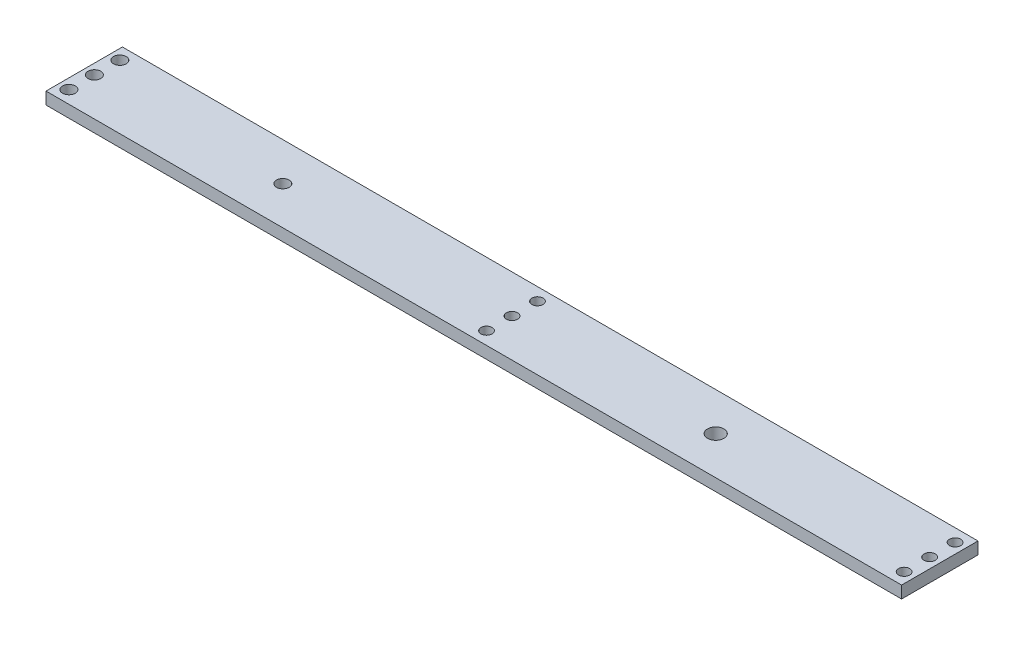
from build123d import *

# Parameters (mm, degrees)
ESBO_O1_R                = 2.5
ESBO_O1_R_2              = 2.2
ESBO_O1_R_3              = 3.225
ESBO_O1_W                = 8
ESBO_O1_H                = 30
RESSALTO_EXTRUS_O1_DEPTH = 4.7625


with BuildPart() as part:
    # Esboço1 → Ressalto-extrusão1 (new body)
    # profile 1 of 2: a face of its own
    with BuildSketch(Plane(origin=(0, 0, 0), x_dir=(1, 0, 0), z_dir=(0, 1, 0))):
        Polygon((-160, -15), (160, -15), (160, 15), (-160, 15), (-168, 15), (-168, -15), align=None)
        with Locations(Location((-164, -10, 0), (0, 0, 90))):
            Circle(ESBO_O1_R, mode=Mode.SUBTRACT)
        with Locations(Location((0, -10, 0), (0, 0, 90))):
            Circle(ESBO_O1_R_2, mode=Mode.SUBTRACT)
        with Locations(Location((-164, 0, 0), (0, 0, 90))):
            Circle(ESBO_O1_R, mode=Mode.SUBTRACT)
        with Locations(Location((-90, 0, 0), (0, 0, 90))):
            Circle(ESBO_O1_R, mode=Mode.SUBTRACT)
        with Locations(Location((-164, 10, 0), (0, 0, 90))):
            Circle(ESBO_O1_R, mode=Mode.SUBTRACT)
        with Locations(Location((0, 0, 0), (0, 0, 90))):
            Circle(ESBO_O1_R_2, mode=Mode.SUBTRACT)
        with Locations(Location((80, 0, 0), (0, 0, 90))):
            Circle(ESBO_O1_R_3, mode=Mode.SUBTRACT)
        with Locations(Location((0, 10, 0), (0, 0, 90))):
            Circle(ESBO_O1_R_2, mode=Mode.SUBTRACT)
    # profile 2 of 2: a face of its own
    with BuildSketch(Plane(origin=(0, 0, 0), x_dir=(1, 0, 0), z_dir=(0, 1, 0))):
        with Locations((164, 0)):
            Rectangle(ESBO_O1_W, ESBO_O1_H)
        with Locations(Location((164, -10, 0), (0, 0, 90))):
            Circle(ESBO_O1_R_2, mode=Mode.SUBTRACT)
        with Locations(Location((164, 0, 0), (0, 0, 90))):
            Circle(ESBO_O1_R_2, mode=Mode.SUBTRACT)
        with Locations(Location((164, 10, 0), (0, 0, 90))):
            Circle(ESBO_O1_R_2, mode=Mode.SUBTRACT)
    extrude(amount=RESSALTO_EXTRUS_O1_DEPTH)


solid = part.part
